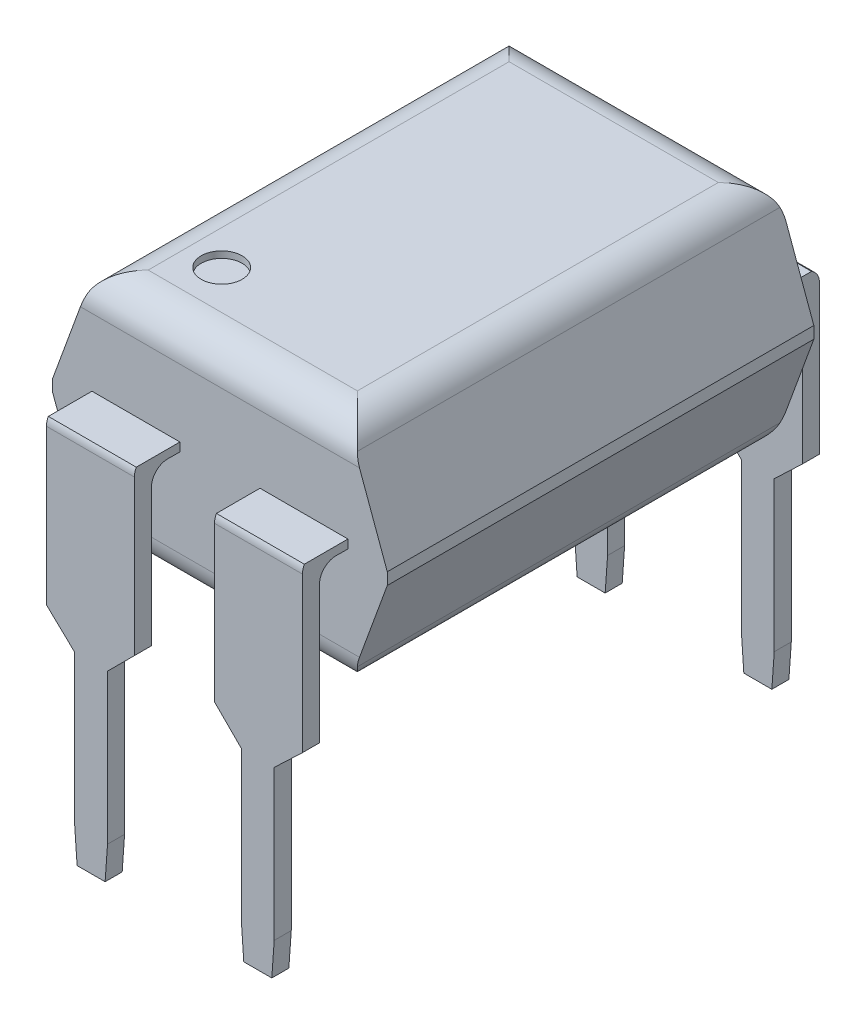
from build123d import *

# Parameters (mm, degrees)
SKETCH1_W               = 5.1
SKETCH1_H               = 6.5
BOSS_EXTRUDE1_DEPTH     = 3.5
SKETCH2_R               = 0.311751624
CUT_EXTRUDE1_DEPTH      = 0.1
SKETCH3_OUTSIDE_W       = 8.894
SKETCH3_OUTSIDE_H       = 7.294
CUT_EXTRUDE3_DEPTH      = 8.81040972
FILLET1_R               = 0.5
BOSS_EXTRUDE2_DEPTH     = 5.1
CUT_EXTRUDE7_DEPTH      = 10.0741376
CUT_EXTRUDE7_DEPTH_BACK = 10.0741376
SKETCH5_OUTSIDE_W       = 9.466
SKETCH5_OUTSIDE_H       = 11.573


with BuildPart() as part:
    # Sketch1 → Boss-Extrude1 (new body)
    with BuildSketch(Plane(origin=(0, 0, 0), x_dir=(1, 0, 0), z_dir=(0, 1, 0))):
        Rectangle(SKETCH1_W, SKETCH1_H)
    extrude(amount=BOSS_EXTRUDE1_DEPTH)

    # Sketch2 → Cut-Extrude1 (cut)
    with BuildSketch(Plane(origin=(0, 3.5, 0), x_dir=(1, 0, 0), z_dir=(0, 1, 0))):
        with Locations(Location((-1.067569718, -2.156407837, 0), (0, 0, 270))):
            Circle(SKETCH2_R)
    extrude(amount=-CUT_EXTRUDE1_DEPTH, mode=Mode.SUBTRACT)

    # Sketch3 outside → Cut-Extrude3 (cut, through all)
    with BuildSketch(Plane.XY.offset(3.25)):
        with Locations((0, 1.75)):
            Rectangle(SKETCH3_OUTSIDE_W, SKETCH3_OUTSIDE_H)
        Polygon((-2.55, 1.84057033), (-1.943948555, 3.5), (1.943948555, 3.5), (2.55, 1.84057033), (2.55, 1.65942967), (1.943948555, 0), (-1.943948555, 0), (-2.55, 1.65942967), align=None, mode=Mode.SUBTRACT)
    extrude(amount=-CUT_EXTRUDE3_DEPTH, mode=Mode.SUBTRACT)

    # Fillet1
    fillet1_edges = [part.edges().sort_by_distance(p)[0] for p in [
        (0, 0, 3.25),
        (0, 0, -3.25),
        (0, 3.5, -3.25),
        (0, 3.5, 3.25),
        (1.943948555, 3.5, 0),
        (-1.943948555, 3.5, 0),
        (1.943948555, 0, 0),
        (-1.943948555, 0, 0),
    ]]
    fillet(fillet1_edges, radius=FILLET1_R)


with BuildPart() as body_2:
    # Sketch4 → Boss-Extrude2 (new, through all)
    with BuildSketch(Plane.ZY.offset(2.55)):
        with BuildLine():
            Line((-3.936643854, -3.707164749), (-3.676643854, -3.707164749))
            Line((-3.676643854, -3.707164749), (-3.676643854, 1.501435709))
            ThreePointArc((-3.676643854, 1.501435709), (-3.6046032, 1.677021788), (-3.430000086, 1.751413179))
            Line((-3.430000086, 1.751413179), (3.430000086, 1.843516476))
            ThreePointArc((3.430000086, 1.843516476), (3.608942396, 1.771498352), (3.683356317, 1.593539006))
            Line((3.683356317, 1.593539006), (3.683356317, -3.707164749))
            Line((3.683356317, -3.707164749), (3.943356317, -3.707164749))
            Line((3.943356317, -3.707164749), (3.943356317, 1.857053234))
            ThreePointArc((3.943356317, 1.857053234), (3.868942396, 2.035012581), (3.690000086, 2.107030705))
            Line((3.690000086, 2.107030705), (-3.690000086, 2.007945817))
            ThreePointArc((-3.690000086, 2.007945817), (-3.8646032, 1.933554425), (-3.936643854, 1.757968346))
            Line((-3.936643854, 1.757968346), (-3.936643854, -3.707164749))
        make_face()
    extrude(amount=-BOSS_EXTRUDE2_DEPTH)

    # Sketch5 outside → Cut-Extrude7 (cut, two sides: drawn at the far end of the back side and taken through both)
    with BuildSketch(Plane(origin=(0, 0, -3.936643854), x_dir=(-1, 0, 0), z_dir=(0, 0, -1)).offset(-CUT_EXTRUDE7_DEPTH_BACK)):
        with Locations((0, -0.1035)):
            Rectangle(SKETCH5_OUTSIDE_W, SKETCH5_OUTSIDE_H)
        Polygon((-1.02, -3.19277423), (-1.02, -0.90942967), (-0.610520763, -0.5), (-0.610520763, 1.757968346), (-0.610520763, 1.973134899), (-1.950520763, 1.973134899), (-1.950520763, 1.757968346), (-1.950520763, -0.5), (-1.52, -0.90942967), (-1.52, -3.19277423), (-1.483452684, -3.707164749), (-1.056547316, -3.707164749), align=None, mode=Mode.SUBTRACT)
        Polygon((1.52, -0.90942967), (1.950520763, -0.5), (1.950520763, 1.757968346), (1.950520763, 1.973134899), (0.610520763, 1.973134899), (0.610520763, 1.757968346), (0.610520763, -0.5), (1.02, -0.90942967), (1.02, -3.19277423), (1.056547316, -3.707164749), (1.483452684, -3.707164749), (1.52, -3.19277423), align=None, mode=Mode.SUBTRACT)
    extrude(amount=CUT_EXTRUDE7_DEPTH + CUT_EXTRUDE7_DEPTH_BACK, mode=Mode.SUBTRACT)


with BuildPart() as cut_extrude7_piece_1:
    # of the separate pieces the step leaves, piece 1, a body of its own (cut_extrude7_pieces)
    add(body_2.part.solids().sort_by_distance((1.950520763, 1.973134899, -3.813936252))[0])


with BuildPart() as cut_extrude7_piece_2:
    # of the separate pieces the step leaves, piece 2, a body of its own (cut_extrude7_pieces)
    add(body_2.part.solids().sort_by_distance((-1.950520763, 1.757968346, -3.936643854))[0])


solid = Compound([part.part, cut_extrude7_piece_1.part, cut_extrude7_piece_2.part])
